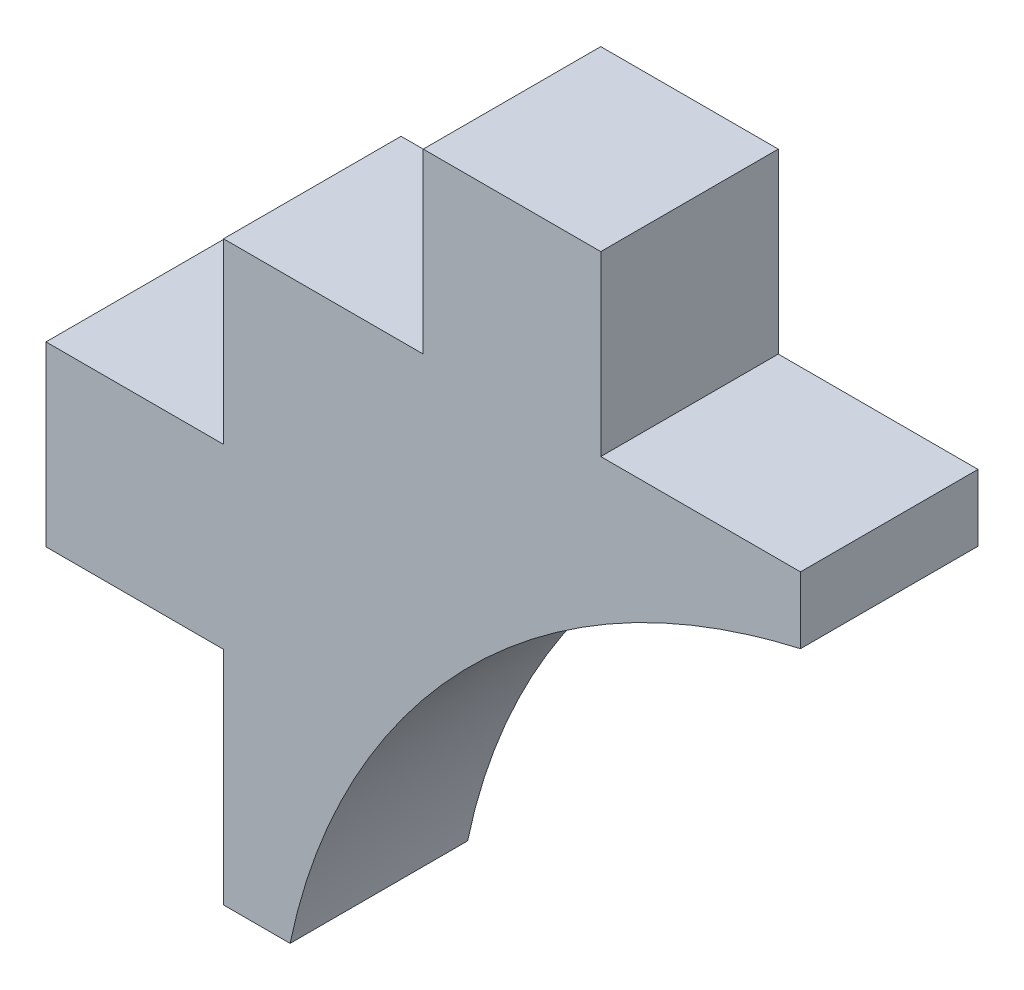
from build123d import *

# Parameters (mm, degrees)
BOSS_EXTRUDE1_DEPTH = 4


with BuildPart() as part:
    # Sketch1 → Boss-Extrude1 (new body)
    with BuildSketch(Plane.XY):
        with BuildLine():
            Line((0, 13), (4.5, 13))
            Line((4.5, 13), (4.5, 17))
            Line((4.5, 17), (8.5, 17))
            Line((8.5, 17), (8.5, 13))
            Line((8.5, 13), (13, 13))
            Line((13, 13), (13, 11.5))
            add(Edge.make_bspline(
                [(1.5, 0), (2.52035849, 4.950366231), (6.473986228, 10.017019138), (13, 11.5)],
                knots=[0, 0, 0, 0, 1, 1, 1, 1], degree=3))
            Line((1.5, 0), (0, 0))
            Line((0, 0), (0, 4.987852908))
            Line((0, 4.987852908), (-4, 4.987852908))
            Line((-4, 4.987852908), (-4, 8.987852908))
            Line((-4, 8.987852908), (0, 8.987852908))
            Line((0, 8.987852908), (0, 13))
        make_face()
    extrude(amount=BOSS_EXTRUDE1_DEPTH)


solid = part.part
